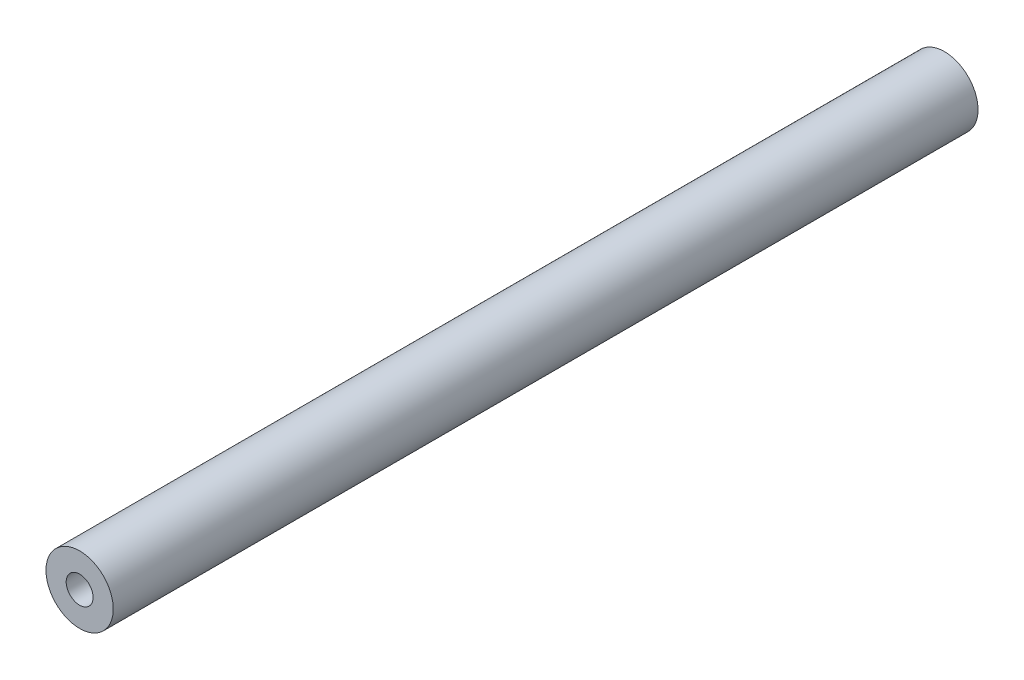
from build123d import *

# Parameters (mm, degrees)
SKIZZE1_R                       = 3.5
AUFSATZ_LINEAR_AUSTRAGEN1_DEPTH = 90
SKIZZE3_R                       = 1.4
SCHNITT_LINEAR_AUSTRAGEN1_DEPTH = 10
SCHNITT_LINEAR_START            = -10
SKIZZE4_R                       = 1.4
SCHNITT_LINEAR_AUSTRAGEN2_DEPTH = 10


with BuildPart() as part:
    # Skizze1 → Aufsatz-Linear austragen1 (new body)
    with BuildSketch(Plane.XY):
        with Locations(Location((0, 0, 0), (0, 0, 180))):
            Circle(SKIZZE1_R)
    extrude(amount=AUFSATZ_LINEAR_AUSTRAGEN1_DEPTH)

    # Skizze3 → Schnitt-Linear austragen1 (cut)
    with BuildSketch(Plane.XY.offset(90)):
        Circle(SKIZZE3_R)
    extrude(amount=-SCHNITT_LINEAR_AUSTRAGEN1_DEPTH, mode=Mode.SUBTRACT)

    # Skizze4 → Schnitt-Linear austragen2 (cut)
    with BuildSketch(Plane(origin=(0, 0, 0), x_dir=(-1, 0, 0), z_dir=(0, 0, -1)).offset(SCHNITT_LINEAR_START)):
        with Locations(Location((0, 0, 0), (0, 0, 180))):
            Circle(SKIZZE4_R)
    extrude(amount=SCHNITT_LINEAR_AUSTRAGEN2_DEPTH, mode=Mode.SUBTRACT)


solid = part.part
